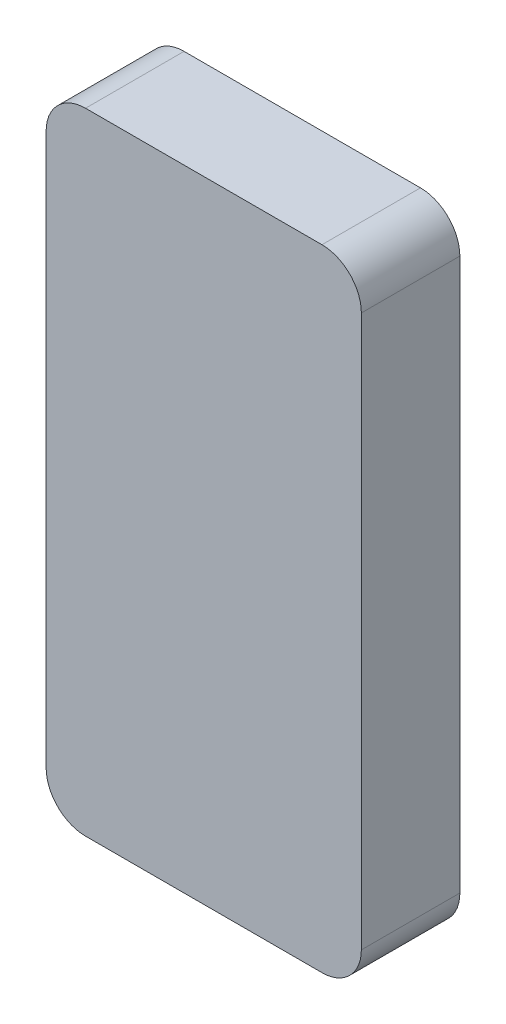
from build123d import *

# Parameters (mm, degrees)
EXTRUDE_1_DEPTH = 25


with BuildPart() as part:
    # 草图1 → 凸台-拉伸1 (new body)
    with BuildSketch(Plane.XY):
        with BuildLine():
            Line((-30, -80), (30, -80))
            ThreePointArc((30, -80), (37.071067812, -77.071067812), (40, -70))
            Line((40, -70), (40, 70))
            ThreePointArc((40, 70), (37.071067812, 77.071067812), (30, 80))
            Line((30, 80), (-30, 80))
            ThreePointArc((-30, 80), (-37.071067812, 77.071067812), (-40, 70))
            Line((-40, 70), (-40, -70))
            ThreePointArc((-40, -70), (-37.071067812, -77.071067812), (-30, -80))
        make_face()
    extrude(amount=EXTRUDE_1_DEPTH)


solid = part.part
